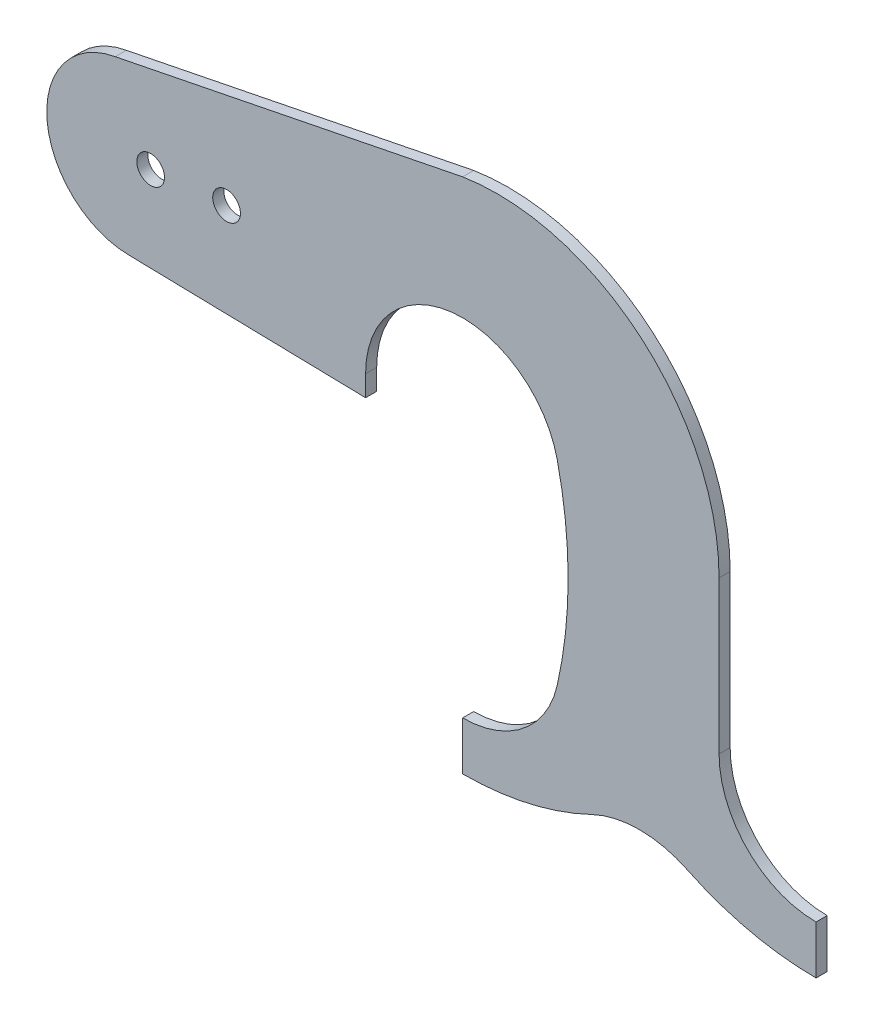
from build123d import *

# Parameters (mm, degrees)
SKETCH1_R           = 12.5
BOSS_EXTRUDE1_DEPTH = 10


with BuildPart() as part:
    # Sketch1 → Boss-Extrude1 (new body)
    with BuildSketch(Plane.XY):
        with BuildLine():
            Line((231.25, 0), (231.25, -137.5))
            ThreePointArc((231.25, -137.5), (256.878155637, -199.371842345), (318.749997146, -225))
            Line((318.749997146, -225), (318.749997146, -268.75))
            ThreePointArc((318.749997146, -268.75), (259.191745399, -262.067504946), (202.595337169, -242.352341572))
            ThreePointArc((202.595337169, -242.352341572), (159.374998573, -232.529957041), (116.154659977, -242.352341572))
            ThreePointArc((116.154659977, -242.352341572), (59.558251747, -262.067504946), (0, -268.75))
            Line((0, -268.75), (0, -225))
            ThreePointArc((0, -225), (54.643732486, -205.839684664), (85.356238788, -156.75))
            ThreePointArc((85.356238788, -156.75), (95.156290044, -68.75), (85.356238788, 19.25))
            ThreePointArc((85.356238788, 19.25), (-9.68450066, 86.96240824), (-87.5, 0))
            Line((-87.5, 0), (-87.5, -18.75))
            Line((-87.5, -18.75), (-300, -14.072527462))
            ThreePointArc((-300, -14.072527462), (-374.703614676, 54.266394967), (-313.269508591, 134.744273754))
            Line((-313.269508591, 134.744273754), (0, 197.543507866))
            ThreePointArc((0, 197.543507866), (161.153810568, 152.069063257), (231.25, 0))
        make_face()
        with Locations((-281.324943498, 62.602215693)):
            Circle(SKETCH1_R, mode=Mode.SUBTRACT)
        with Locations((-212.849736322, 68.742940594)):
            Circle(SKETCH1_R, mode=Mode.SUBTRACT)
    extrude(amount=BOSS_EXTRUDE1_DEPTH)


solid = part.part
